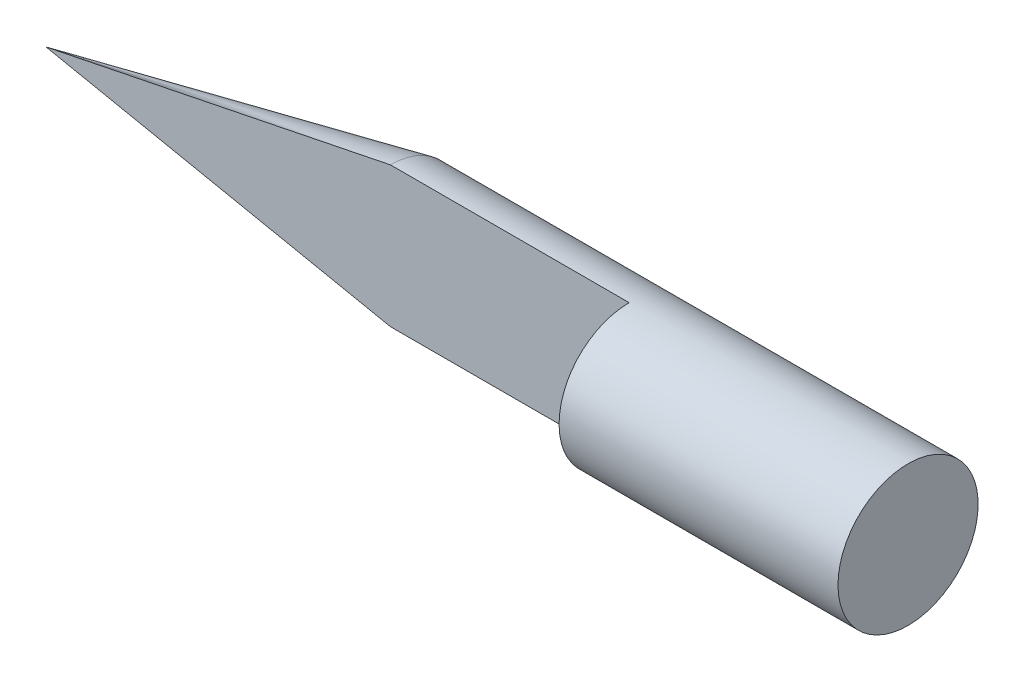
from build123d import *

# Parameters (mm, degrees)
REVOLVE_1_ANGLE = 180
SKETCH_3_R      = 3.015163077
EXTRUDE_2_DEPTH = 12


with BuildPart() as part:
    # 草圖1 → 旋轉1 (revolve)
    with BuildSketch(Plane.XY):
        Polygon((14.82, 0), (0, 0), (14.82, -3.015163077), (37.09, -3.015163077), (37.09, 0), align=None)
    revolve(axis=Axis((0, 0, 0), (1, 0, 0)), revolution_arc=REVOLVE_1_ANGLE)

    # 草圖3 → 填料-伸長2 (add)
    with BuildSketch(Plane(origin=(37.09, 0, 0), x_dir=(0, 0, -1), z_dir=(1, 0, 0))):
        with Locations(Location((0, 0, 0), (0, 0, 180))):
            Circle(SKETCH_3_R)
    extrude(amount=-EXTRUDE_2_DEPTH)


solid = part.part
